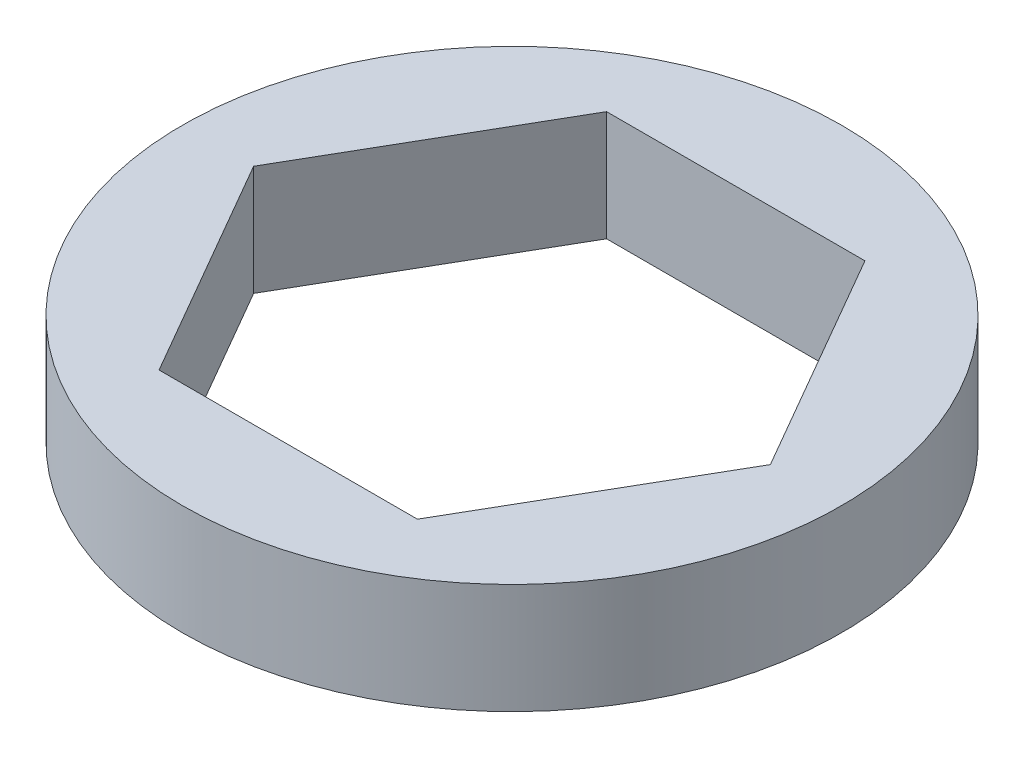
from build123d import *

# Parameters (mm, degrees)
SKETCH1_R           = 9.5
BOSS_EXTRUDE1_DEPTH = 3.175


with BuildPart() as part:
    # Sketch1 → Boss-Extrude1 (new body)
    with BuildSketch(Plane(origin=(0, 0, 0), x_dir=(1, 0, 0), z_dir=(0, 1, 0))):
        with Locations(Location((0, 0, 0), (0, 0, 270))):
            Circle(SKETCH1_R)
        Polygon((7.447818473, 0), (3.723909236, 6.45), (-3.723909236, 6.45), (-7.447818473, 0), (-3.723909236, -6.45), (3.723909236, -6.45), align=None, mode=Mode.SUBTRACT)
    extrude(amount=BOSS_EXTRUDE1_DEPTH)


solid = part.part
